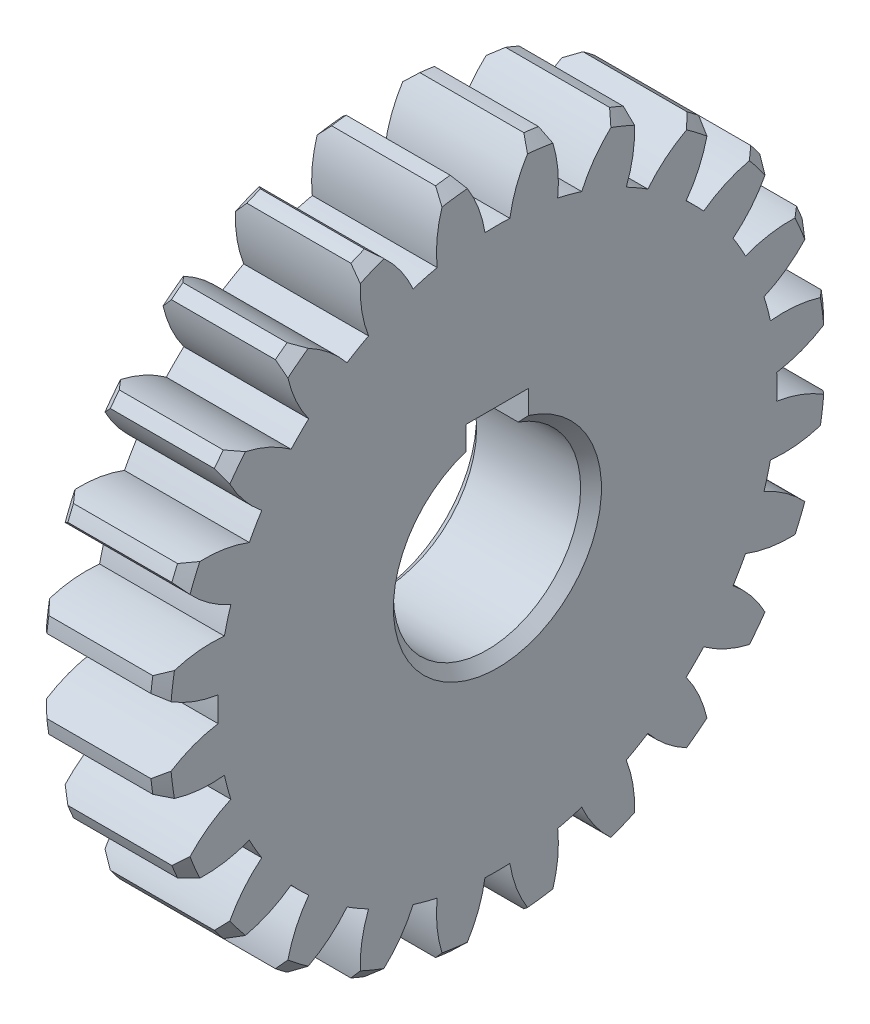
from build123d import *

# Parameters (mm, degrees)
BASPROSKE_W     = 12
BASPROSKE_H     = 32.5
TOOTHCUT_DEPTH  = 48.502631506
TEETHCUTS_COUNT = 24
TEETHCUTS_ANGLE = 345
BORSKE_R        = 9
BORE_DEPTH      = 50.0000508
KEYSKE_W        = 6
KEYSKE_H        = 11.8
KEYWAY_DEPTH    = 50.0000508
CHAMFER1_SIZE   = 1


with BuildPart() as part:
    # BasProSke → Base-Revolve (revolve)
    with BuildSketch(Plane(origin=(0, 0, 0), x_dir=(1, 0, 0), z_dir=(0, 1, 0)), mode=Mode.PRIVATE) as base_revolve_sk:
        with Locations((6, 16.25)):
            Rectangle(BASPROSKE_W, BASPROSKE_H)
    revolve(base_revolve_sk.sketch.rotate(Axis((-10, 0, 0), (1, 0, 0)), 180), axis=Axis((-10, 0, 0), (1, 0, 0)))

    # TooCutSke → ToothCut (cut, through all)
    with BuildSketch(Plane(origin=(0, 0, 0), x_dir=(0, 0, -1), z_dir=(1, 0, 0))):
        with BuildLine():
            ThreePointArc((1.196304146, 26.847359877), (0, 26.874), (-1.196304146, 26.847359877))
            ThreePointArc((-1.196304146, 26.847359877), (-2.031613036, 29.738020513), (-3.559760234, 32.33001318))
            ThreePointArc((-3.559760234, 32.33001318), (0, 32.5254), (3.559760234, 32.33001318))
            ThreePointArc((3.559760234, 32.33001318), (2.031613036, 29.738020513), (1.196304146, 26.847359877))
        make_face()
    toothcut = extrude(amount=TOOTHCUT_DEPTH, mode=Mode.SUBTRACT)

    # TeethCuts: ToothCut ×24 about axis
    teethcuts_axis = Axis((-10, 0, 0), (1, 0, 0))
    for i in range(1, TEETHCUTS_COUNT):
        add(toothcut.rotate(teethcuts_axis, i * TEETHCUTS_ANGLE / (TEETHCUTS_COUNT - 1)), mode=Mode.SUBTRACT)

    # BorSke → Bore (cut, symmetric)
    with BuildSketch(Plane(origin=(0, 0, 0), x_dir=(0, 0, -1), z_dir=(1, 0, 0))):
        with Locations(Location((0, 0, 0), (0, 0, 180))):
            Circle(BORSKE_R)
    extrude(amount=BORE_DEPTH, both=True, mode=Mode.SUBTRACT)

    # KeySke → Keyway (cut, symmetric)
    with BuildSketch(Plane(origin=(0, 0, 0), x_dir=(0, 0, -1), z_dir=(1, 0, 0))):
        with Locations((0, 5.9)):
            Rectangle(KEYSKE_W, KEYSKE_H)
    extrude(amount=KEYWAY_DEPTH, both=True, mode=Mode.SUBTRACT)

    # Chamfer1
    chamfer1_edges = [part.edges().sort_by_distance(p)[0] for p in [
        (12, 4.242101247, 32.221957995),
        (12, 12.437211552, 30.026084807),
        (12, 19.784746443, 25.783983559),
        (12, 25.783983559, 19.784746443),
        (12, 30.026084807, 12.437211552),
        (12, 32.221957995, -4.242101247),
        (0, 32.221957995, 4.242101247),
        (12, 32.221957995, 4.242101247),
        (0, 30.026084807, -12.437211552),
        (0, 25.783983559, -19.784746443),
        (0, -9, 0),
        (12, -9, 0),
        (0, 19.784746443, -25.783983559),
        (0, 12.437211552, -30.026084807),
        (0, 4.242101247, -32.221957995),
        (0, -4.242101247, -32.221957995),
        (0, -12.437211552, -30.026084807),
        (0, -19.784746443, -25.783983559),
        (0, -25.783983559, -19.784746443),
        (0, -30.026084807, -12.437211552),
        (0, -32.221957995, -4.242101247),
        (0, -32.221957995, 4.242101247),
        (0, -30.026084807, 12.437211552),
        (0, -25.783983559, 19.784746443),
        (0, -19.784746443, 25.783983559),
        (0, -12.437211552, 30.026084807),
        (0, -4.242101247, 32.221957995),
        (0, 4.242101247, 32.221957995),
        (0, 12.437211552, 30.026084807),
        (0, 19.784746443, 25.783983559),
        (0, 25.783983559, 19.784746443),
        (0, 30.026084807, 12.437211552),
        (0, 32.221957995, -4.242101247),
        (12, 30.026084807, -12.437211552),
        (12, 25.783983559, -19.784746443),
        (12, 19.784746443, -25.783983559),
        (12, 12.437211552, -30.026084807),
        (12, 4.242101247, -32.221957995),
        (12, -4.242101247, -32.221957995),
        (12, -12.437211552, -30.026084807),
        (12, -19.784746443, -25.783983559),
        (12, -25.783983559, -19.784746443),
        (12, -30.026084807, -12.437211552),
        (12, -32.221957995, -4.242101247),
        (12, -32.221957995, 4.242101247),
        (12, -30.026084807, 12.437211552),
        (12, -25.783983559, 19.784746443),
        (12, -19.784746443, 25.783983559),
        (12, -12.437211552, 30.026084807),
        (12, -4.242101247, 32.221957995),
    ]]
    chamfer(chamfer1_edges, length=CHAMFER1_SIZE)


solid = part.part
